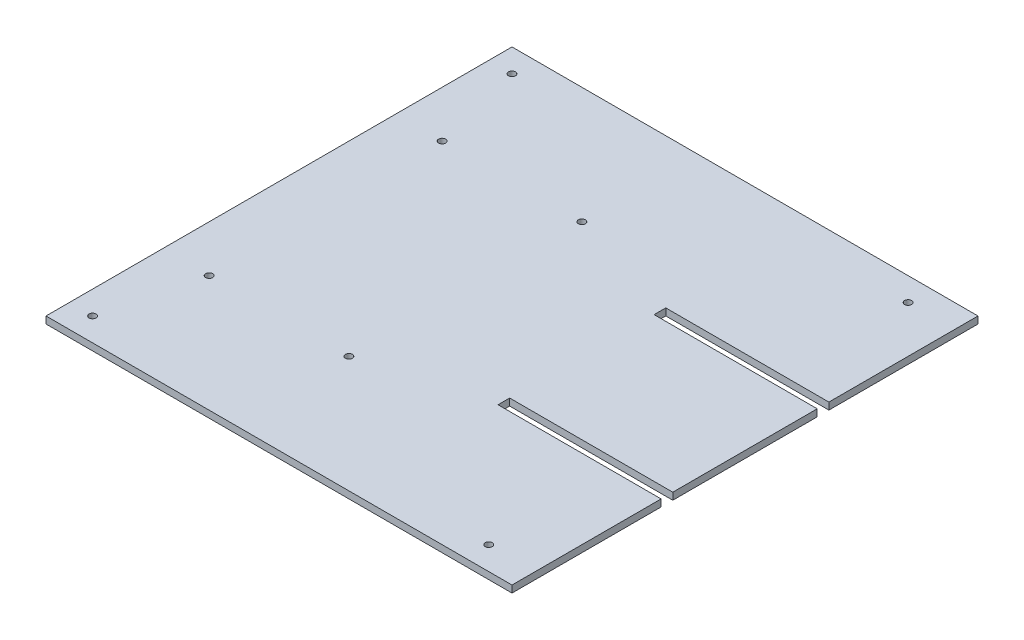
from build123d import *

# Parameters (mm, degrees)
SKETCH1_W           = 200
SKETCH1_H           = 200
BOSS_EXTRUDE1_DEPTH = 3
SKETCH2_R           = 1.5
CUT_EXTRUDE1_DEPTH  = 3
SKETCH3_W           = 70
SKETCH3_H           = 5
CUT_EXTRUDE2_DEPTH  = 3
SKETCH4_R           = 1.5
CUT_EXTRUDE5_DEPTH  = 3


with BuildPart() as part:
    # Sketch1 → Boss-Extrude1 (new body)
    with BuildSketch(Plane(origin=(0, 0, 0), x_dir=(1, 0, 0), z_dir=(0, 1, 0))):
        Rectangle(SKETCH1_W, SKETCH1_H)
    extrude(amount=BOSS_EXTRUDE1_DEPTH)

    # Sketch2 → Cut-Extrude1 (cut)
    with BuildSketch(Plane(origin=(0, 3, 0), x_dir=(1, 0, 0), z_dir=(0, 1, 0))):
        with Locations(Location((-90, -90, 0), (0, 0, 270))):
            Circle(SKETCH2_R)
        with Locations(Location((80, -90, 0), (0, 0, 270))):
            Circle(SKETCH2_R)
        with Locations(Location((80, 90, 0), (0, 0, 90))):
            Circle(SKETCH2_R)
        with Locations(Location((-90, 90, 0), (0, 0, 90))):
            Circle(SKETCH2_R)
    extrude(amount=-CUT_EXTRUDE1_DEPTH, mode=Mode.SUBTRACT)

    # Sketch3 → Cut-Extrude2 (cut)
    with BuildSketch(Plane(origin=(0, 3, 0), x_dir=(1, 0, 0), z_dir=(0, 1, 0))):
        with Locations((65, -33.5)):
            Rectangle(SKETCH3_W, SKETCH3_H)
        with Locations((65, 33.5)):
            Rectangle(SKETCH3_W, SKETCH3_H)
    extrude(amount=-CUT_EXTRUDE2_DEPTH, mode=Mode.SUBTRACT)

    # Sketch4 → Cut-Extrude5 (cut)
    with BuildSketch(Plane(origin=(0, 3, 0), x_dir=(1, 0, 0), z_dir=(0, 1, 0))):
        with Locations(Location((-80, -50, 0), (0, 0, 270))):
            Circle(SKETCH4_R)
        with Locations(Location((-20, -50, 0), (0, 0, 270))):
            Circle(SKETCH4_R)
        with Locations(Location((-80, 50, 0), (0, 0, 270))):
            Circle(SKETCH4_R)
        with Locations(Location((-20, 50, 0), (0, 0, 270))):
            Circle(SKETCH4_R)
    extrude(amount=-CUT_EXTRUDE5_DEPTH, mode=Mode.SUBTRACT)


solid = part.part
